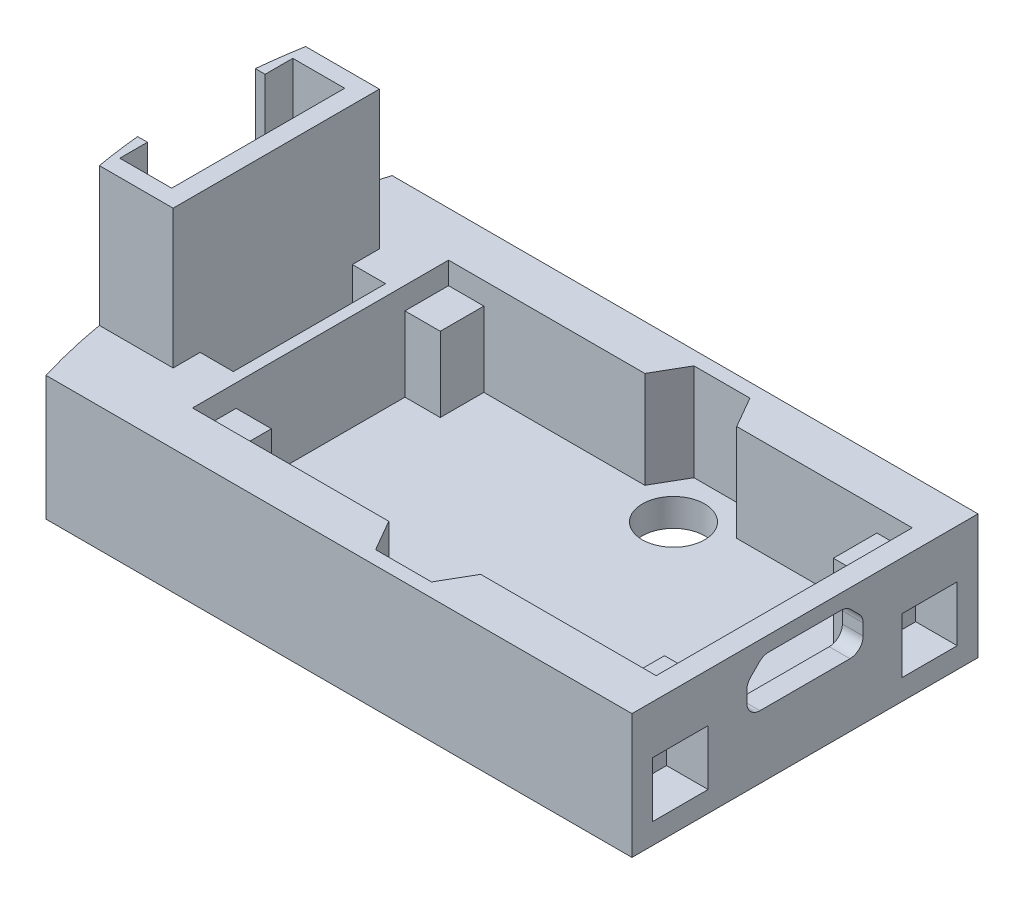
from build123d import *

# Parameters (mm, degrees)
BOSS_EXTRUDE1_DEPTH  = 9
SKETCH17_W           = 33.5
SKETCH17_H           = 18.5
CUT_EXTRUDE8_DEPTH   = 7
SKETCH18_W           = 2.55
SKETCH18_H           = 3.15
BOSS_EXTRUDE2_DEPTH  = 5.4
CUT_EXTRUDE13_REACH  = 49.509
CUT_EXTRUDE15_REACH  = 30.68
SKETCH27_R           = 2.25
CUT_EXTRUDE14_DEPTH  = 7
SKETCH28_W           = 2.4
SKETCH28_H           = 11
CUT_EXTRUDE16_DEPTH  = 5
SKETCH29_W           = 4
SKETCH29_H           = 4
CUT_EXTRUDE17_DEPTH  = 3
BOSS_EXTRUDE4_DEPTH  = 10
SKETCH33_OUTSIDE_W   = 57.507
SKETCH33_OUTSIDE_H   = 43.336
SKETCH33_OUTSIDE_W_2 = 61.074574046
SKETCH33_OUTSIDE_H_2 = 25
CUT_EXTRUDE24_DEPTH  = 34.683188999


with BuildPart() as part:
    # Sketch1 → Boss-Extrude1 (new body)
    with BuildSketch(Plane(origin=(0, 0, 0), x_dir=(1, 0, 0), z_dir=(0, 1, 0))):
        with BuildLine():
            Line((-20.75, 15), (20.75, 15))
            Line((20.75, 15), (20.75, -15))
            Line((20.75, -15), (-20.75, -15))
            ThreePointArc((-20.75, -15), (-23.421298451, 0), (-20.75, 15))
        make_face()
    extrude(amount=BOSS_EXTRUDE1_DEPTH)

    # Sketch17 → Cut-Extrude8 (cut)
    with BuildSketch(Plane(origin=(0, 9, 0), x_dir=(1, 0, 0), z_dir=(0, 1, 0))):
        with Locations((2.5, 0)):
            Rectangle(SKETCH17_W, SKETCH17_H)
    extrude(amount=-CUT_EXTRUDE8_DEPTH, mode=Mode.SUBTRACT)

    # Sketch18 → Boss-Extrude2 (add)
    with BuildSketch(Plane(origin=(0, 2, 0), x_dir=(1, 0, 0), z_dir=(0, 1, 0))):
        with Locations((-12.975, 7.675)):
            Rectangle(SKETCH18_W, SKETCH18_H)
        with Locations((-12.975, -7.675)):
            Rectangle(SKETCH18_W, SKETCH18_H)
        with Locations((17.975, 7.675)):
            Rectangle(SKETCH18_W, SKETCH18_H)
        with Locations((17.975, -7.675)):
            Rectangle(SKETCH18_W, SKETCH18_H)
    extrude(amount=BOSS_EXTRUDE2_DEPTH)

    # Sketch25 → Cut-Extrude13 (cut, up to next)
    with BuildSketch(Plane(origin=(20.75, 0, 0), x_dir=(0, 0, -1), z_dir=(1, 0, 0)), mode=Mode.PRIVATE) as cut_extrude13_sk1:
        with BuildLine():
            Line((3.921751442, 6.999799178), (3.28890873, 7.63264189))
            ThreePointArc((3.28890873, 7.63264189), (2.980706548, 7.838576004), (2.617157288, 7.910890448))
            Line((2.617157288, 7.910890448), (-2.617157288, 7.910890448))
            ThreePointArc((-2.617157288, 7.910890448), (-2.980706548, 7.838576004), (-3.28890873, 7.63264189))
            Line((-3.28890873, 7.63264189), (-3.921751442, 6.999799178))
            ThreePointArc((-3.921751442, 6.999799178), (-4.127534378, 6.691961757), (-4.199999672, 6.328837431))
            Line((-4.199999672, 6.328837431), (-4.2, 5.510890448))
            ThreePointArc((-4.2, 5.510890448), (-3.921751442, 4.839139006), (-3.25, 4.560890448))
            Line((-3.25, 4.560890448), (3.25, 4.560890448))
            ThreePointArc((3.25, 4.560890448), (3.921751442, 4.839139006), (4.2, 5.510890448))
            Line((4.2, 5.510890448), (4.2, 6.329548061))
            Line((4.2, 6.329548061), (4.199995261, 6.331048392))
            ThreePointArc((4.199995261, 6.331048392), (4.12711031, 6.692982667), (3.921751442, 6.999799178))
        make_face()
    cut_extrude13_tool1 = extrude(cut_extrude13_sk1.sketch, amount=-CUT_EXTRUDE13_REACH, mode=Mode.PRIVATE) & part.part
    add(cut_extrude13_tool1.solids().sort_by_distance((20.75, 6.185522, 0))[0], mode=Mode.SUBTRACT)

    # Sketch27 → Cut-Extrude15 (cut, up to next)
    with BuildSketch(Plane(origin=(0, 2, 0), x_dir=(1, 0, 0), z_dir=(0, 1, 0)), mode=Mode.PRIVATE) as cut_extrude15_sk1:
        with Locations(Location((3.25, -8, 0), (0, 0, 326.251011404))):
            Circle(SKETCH27_R)
    cut_extrude15_tool1 = extrude(cut_extrude15_sk1.sketch, amount=-CUT_EXTRUDE15_REACH, mode=Mode.PRIVATE) & part.part
    # Sketch27 → Cut-Extrude15 (cut, up to next)
    with BuildSketch(Plane(origin=(0, 2, 0), x_dir=(1, 0, 0), z_dir=(0, 1, 0)), mode=Mode.PRIVATE) as cut_extrude15_sk2:
        with Locations(Location((3.25, 8, 0), (0, 0, 33.748988596))):
            Circle(SKETCH27_R)
    cut_extrude15_tool2 = extrude(cut_extrude15_sk2.sketch, amount=-CUT_EXTRUDE15_REACH, mode=Mode.PRIVATE) & part.part
    add(cut_extrude15_tool1.solids().sort_by_distance((3.25, 2, 8))[0], mode=Mode.SUBTRACT)
    add(cut_extrude15_tool2.solids().sort_by_distance((3.25, 2, -8))[0], mode=Mode.SUBTRACT)

    # Sketch26 → Cut-Extrude14 (cut)
    with BuildSketch(Plane(origin=(0, 9, 0), x_dir=(1, 0, 0), z_dir=(0, 1, 0))):
        Polygon((5.270725942, -4.5), (1.229274058, -4.5), (-0.791451884, -8), (1.229274058, -11.5), (5.270725942, -11.5), (7.291451884, -8), align=None)
        Polygon((7.291451884, 8), (5.270725942, 4.5), (1.229274058, 4.5), (-0.791451884, 8), (1.229274058, 11.5), (5.270725942, 11.5), align=None)
    extrude(amount=-CUT_EXTRUDE14_DEPTH, mode=Mode.SUBTRACT)

    # Sketch28 → Cut-Extrude16 (cut)
    with BuildSketch(Plane(origin=(0, 9, 0), x_dir=(1, 0, 0), z_dir=(0, 1, 0))):
        with Locations((-16.25, 0)):
            Rectangle(SKETCH28_W, SKETCH28_H)
    extrude(amount=-CUT_EXTRUDE16_DEPTH, mode=Mode.SUBTRACT)

    # Sketch29 → Cut-Extrude17 (cut)
    with BuildSketch(Plane(origin=(20.75, 0, 0), x_dir=(0, 0, -1), z_dir=(1, 0, 0))):
        with Locations((-9, 3.5)):
            Rectangle(SKETCH29_W, SKETCH29_H)
        with Locations((9, 3.5)):
            Rectangle(SKETCH29_W, SKETCH29_H)
    extrude(amount=-CUT_EXTRUDE17_DEPTH, mode=Mode.SUBTRACT)

    # Sketch32 → Boss-Extrude4 (add)
    with BuildSketch(Plane(origin=(0, 9, 0), x_dir=(1, 0, 0), z_dir=(0, 1, 0))):
        with BuildLine():
            Line((-22.005035217, 6.25), (-18.755035217, 6.25))
            Line((-18.755035217, 6.25), (-18.755035217, -6.25))
            Line((-18.755035217, -6.25), (-22.505035217, -6.25))
            Line((-22.505035217, -6.25), (-22.505035217, -4.25))
            Line((-22.505035217, -4.25), (-23.212945043, -4.25))
            ThreePointArc((-23.212945043, -4.25), (-23.025133018, -5.854043824), (-22.777840007, -7.45))
            Line((-22.777840007, -7.45), (-17.45, -7.45))
            Line((-17.45, -7.45), (-17.45, -5.5))
            Line((-17.45, -5.5), (-17.45, 5.5))
            Line((-17.45, 5.5), (-17.45, 7.45))
            Line((-17.45, 7.45), (-22.777840007, 7.45))
            ThreePointArc((-22.777840007, 7.45), (-23.025133018, 5.854043824), (-23.212945043, 4.25))
            Line((-23.212945043, 4.25), (-22.505035217, 4.25))
            Line((-22.505035217, 4.25), (-22.505035217, 6.25))
            Line((-22.505035217, 6.25), (-22.005035217, 6.25))
        make_face()
    extrude(amount=BOSS_EXTRUDE4_DEPTH)

    # Sketch33 outside → Cut-Extrude24 (cut, through all)
    with BuildSketch(Plane(origin=(0, 0, 0), x_dir=(1, 0, 0), z_dir=(0, 1, 0))):
        with Locations((-1.3355, 0)):
            Rectangle(SKETCH33_OUTSIDE_W, SKETCH33_OUTSIDE_H)
        Rectangle(SKETCH33_OUTSIDE_W_2, SKETCH33_OUTSIDE_H_2, mode=Mode.SUBTRACT)
    extrude(amount=CUT_EXTRUDE24_DEPTH, mode=Mode.SUBTRACT)


solid = part.part
